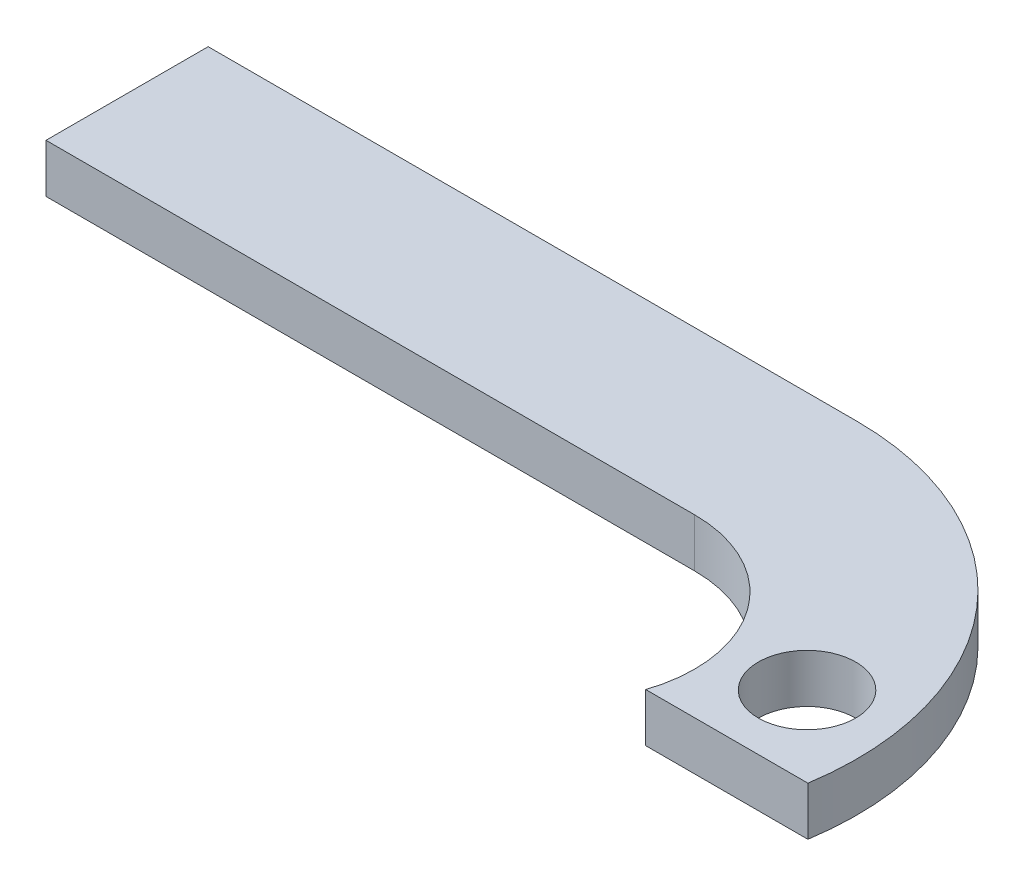
from build123d import *

# Parameters (mm, degrees)
BOSS_EXTRUDE1_DEPTH = 15
SKETCH5_R           = 15
CUT_EXTRUDE1_DEPTH  = 31


with BuildPart() as part:
    # Sketch4 → Boss-Extrude1 (new body)
    with BuildSketch(Plane(origin=(0, 0, 0), x_dir=(1, 0, 0), z_dir=(0, 1, 0))):
        with BuildLine():
            Line((0, -50), (200, -50))
            ThreePointArc((200, -50), (233.424270678, -67.095996649), (239.124306246, -104.203469835))
            Line((239.124306246, -104.203469835), (289.124306246, -104.203469835))
            ThreePointArc((289.124306246, -104.203469835), (268.559290197, -31.577195792), (200, 0))
            Line((200, 0), (0, 0))
            Line((0, 0), (0, -50))
        make_face()
    extrude(amount=BOSS_EXTRUDE1_DEPTH)

    # Sketch5 → Cut-Extrude1 (cut)
    with BuildSketch(Plane(origin=(0, 15, 0), x_dir=(1, 0, 0), z_dir=(0, 1, 0))):
        with Locations(Location((264.124306246, -79.466665475, 0), (0, 0, 270))):
            Circle(SKETCH5_R)
    extrude(amount=-CUT_EXTRUDE1_DEPTH, mode=Mode.SUBTRACT)


solid = part.part
